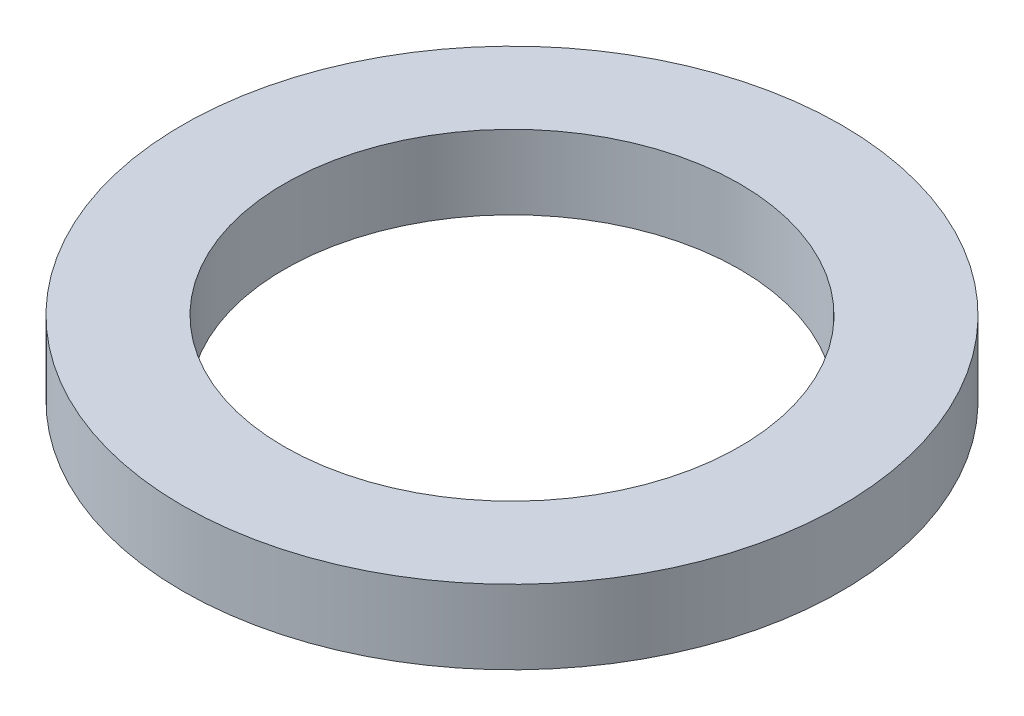
from build123d import *

# Parameters (mm, degrees)
SKETCH1_R           = 2.2606
BOSS_EXTRUDE1_DEPTH = 0.508
SKETCH5_R           = 1.5621
CUT_EXTRUDE1_DEPTH  = 4.237080277


with BuildPart() as part:
    # Sketch1 → Boss-Extrude1 (new body)
    with BuildSketch(Plane(origin=(0, 0, 0), x_dir=(1, 0, 0), z_dir=(0, 1, 0))):
        with Locations(Location((0, 0, 0), (0, 0, 270))):
            Circle(SKETCH1_R)
    extrude(amount=BOSS_EXTRUDE1_DEPTH)

    # Sketch5 → Cut-Extrude1 (cut, through all)
    with BuildSketch(Plane(origin=(0, 0.508, 0), x_dir=(-1, 0, 0), z_dir=(0, 1, 0))):
        with Locations(Location((0, 0, 0), (0, 0, 90))):
            Circle(SKETCH5_R)
    extrude(amount=-CUT_EXTRUDE1_DEPTH, mode=Mode.SUBTRACT)


solid = part.part
